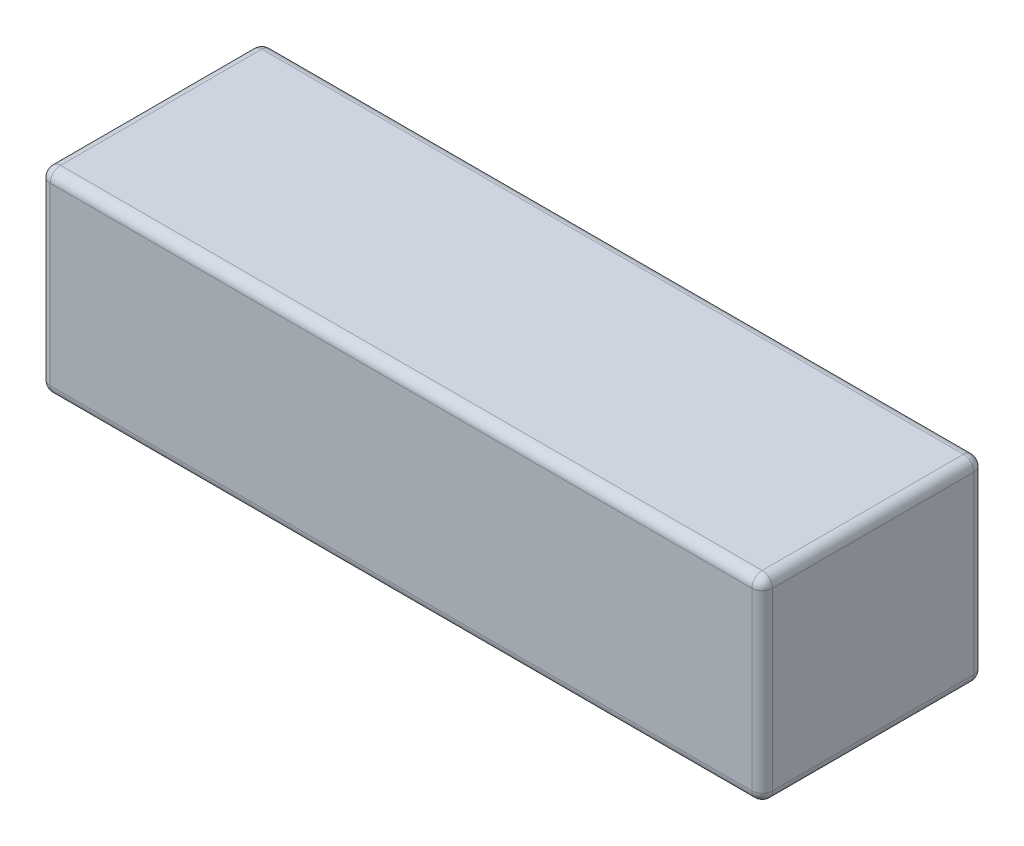
from build123d import *

# Parameters (mm, degrees)
SZKIC1_W                    = 140
SZKIC1_H                    = 43
DODANIE_WYCI_GNI_CIE1_DEPTH = 38
ZAOKR_GLENIE1_R             = 2


with BuildPart() as part:
    # Szkic1 → Dodanie-wyciągnięcie1 (new body)
    with BuildSketch(Plane(origin=(0, 0, 0), x_dir=(1, 0, 0), z_dir=(0, 1, 0))):
        Rectangle(SZKIC1_W, SZKIC1_H)
    extrude(amount=DODANIE_WYCI_GNI_CIE1_DEPTH)

    # Zaokrąglenie1
    zaokr_glenie1_edges = [part.edges().sort_by_distance(p)[0] for p in [
        (-70, 38, 0),
        (0, 38, 21.5),
        (70, 38, 0),
        (0, 0, 21.5),
        (-70, 0, 0),
        (0, 0, -21.5),
        (70, 0, 0),
        (70, 19, 21.5),
        (-70, 19, 21.5),
        (-70, 19, -21.5),
        (70, 19, -21.5),
        (0, 38, -21.5),
    ]]
    fillet(zaokr_glenie1_edges, radius=ZAOKR_GLENIE1_R)


solid = part.part
